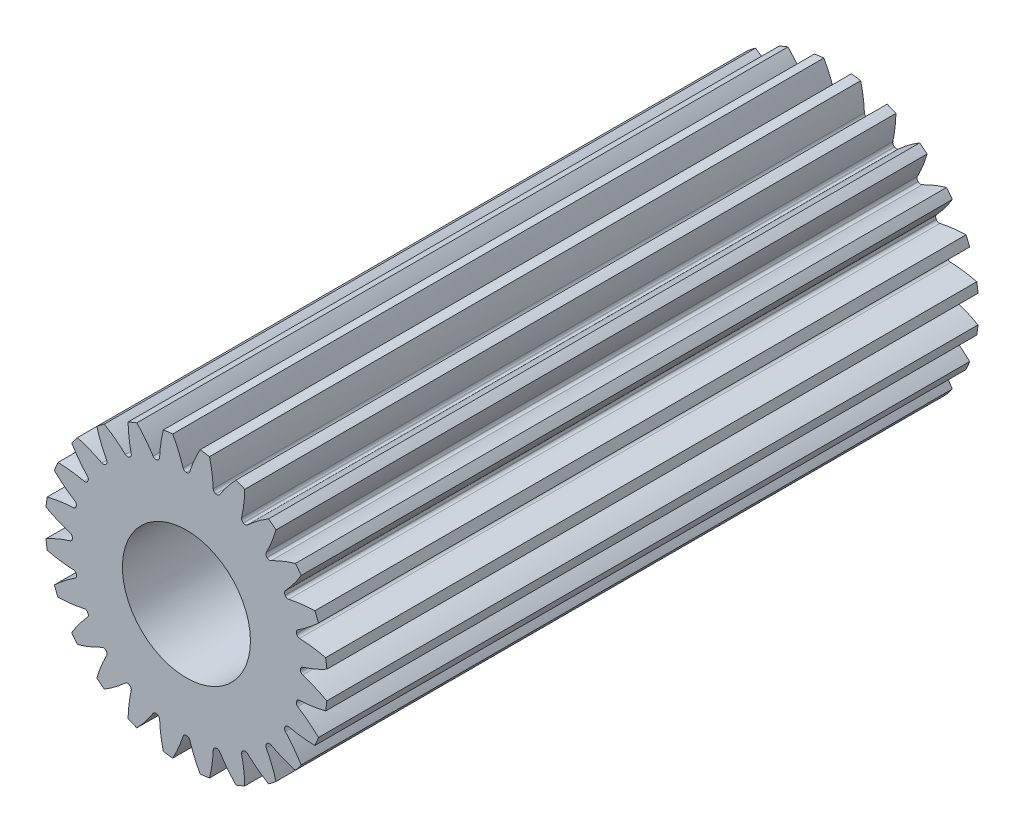
from build123d import *
from build123d.topology import SkipClean

# Parameters (mm, degrees)
CUT_EXTRUDE2_DEPTH  = 10.669539803
CIRPATTERN1_COUNT   = 24
BOSS_EXTRUDE1_START = 27
BOSS_EXTRUDE1_DEPTH = 27
CUT_EXTRUDE3_DEPTH  = 10
SKETCH10_R          = 2.949994
CUT_EXTRUDE4_DEPTH  = 10
FILLET1_R           = 0.25


with BuildPart() as part:
    # Sketch4 → Revolve1 (revolve)
    with BuildSketch(Plane(origin=(0, 0, 0), x_dir=(0, 0, -1), z_dir=(1, 0, 0))):
        Polygon((-3, 4), (-3, 6.5), (0, 6.5), (0, 2), (0, 0), (-3, 0), (-3, 2), align=None)
    revolve(axis=Axis((0, 0, 3), (0, 0, 1)))

    # Sketch7 → Cut-Extrude2 (cut, through all)
    with BuildSketch(Plane.XY.offset(3)):
        with BuildLine():
            ThreePointArc((-0.012291339, 5.249985612), (0, 5.25), (0.012291339, 5.249985612))
            ThreePointArc((0.012291339, 5.249985612), (0.10141019, 5.279068119), (0.155863571, 5.355375334))
            ThreePointArc((0.155863571, 5.355375334), (0.365213913, 5.92435749), (0.630915262, 6.469307995))
            ThreePointArc((0.630915262, 6.469307995), (0, 6.5), (-0.630915262, 6.469307995))
            ThreePointArc((-0.630915262, 6.469307995), (-0.365213913, 5.92435749), (-0.155863571, 5.355375334))
            ThreePointArc((-0.155863571, 5.355375334), (-0.10141019, 5.279068119), (-0.012291339, 5.249985612))
        make_face()
    cut_extrude2 = extrude(amount=-CUT_EXTRUDE2_DEPTH, mode=Mode.SUBTRACT)

    # CirPattern1: Cut-Extrude2 ×24 about axis
    cirpattern1_axis = Axis((0, 0, 0), (0, 0, 1))
    for i in range(1, CIRPATTERN1_COUNT):
        add(cut_extrude2.rotate(cirpattern1_axis, i * 360 / CIRPATTERN1_COUNT), mode=Mode.SUBTRACT)

    # Sketch8 → Boss-Extrude1 (add)
    with SkipClean():  # the faces are left unmerged after this step: merging them gives an invalid solid
        with BuildSketch(Plane.XY.offset(3).offset(BOSS_EXTRUDE1_START)):
            with BuildLine():
                ThreePointArc((-1.536625779, 5.132554884), (-1.886106099, 5.627965588), (-2.283797464, 6.085578785))
                ThreePointArc((-2.283797464, 6.085578785), (-2.48744231, 6.005216961), (-2.688265353, 5.918042699))
                ThreePointArc((-2.688265353, 5.918042699), (-2.645894219, 5.313251044), (-2.542705855, 4.715822871))
                ThreePointArc((-2.542705855, 4.715822871), (-2.551710259, 4.622512194), (-2.614348194, 4.552766579))
                ThreePointArc((-2.614348194, 4.552766579), (-2.625, 4.54663337), (-2.635637418, 4.54047524))
                ThreePointArc((-2.635637418, 4.54047524), (-2.72735786, 4.521102004), (-2.812669479, 4.559959301))
                ThreePointArc((-2.812669479, 4.559959301), (-3.278463271, 4.948037131), (-3.781042642, 5.287127437))
                ThreePointArc((-3.781042642, 5.287127437), (-3.956949289, 5.156796712), (-4.128367093, 5.020616013))
                ThreePointArc((-4.128367093, 5.020616013), (-3.930908121, 4.44739859), (-3.676610026, 3.897034402))
                ThreePointArc((-3.676610026, 3.897034402), (-3.661157032, 3.804572698), (-3.703609138, 3.720991716))
                ThreePointArc((-3.703609138, 3.720991716), (-3.712310601, 3.712310601), (-3.720991716, 3.703609138))
                ThreePointArc((-3.720991716, 3.703609138), (-3.804572698, 3.661157032), (-3.897034402, 3.676610026))
                ThreePointArc((-3.897034402, 3.676610026), (-4.44739859, 3.930908121), (-5.020616013, 4.128367093))
                ThreePointArc((-5.020616013, 4.128367093), (-5.156796712, 3.956949289), (-5.287127437, 3.781042642))
                ThreePointArc((-5.287127437, 3.781042642), (-4.948037131, 3.278463271), (-4.559959301, 2.812669479))
                ThreePointArc((-4.559959301, 2.812669479), (-4.521102004, 2.72735786), (-4.54047524, 2.635637418))
                ThreePointArc((-4.54047524, 2.635637418), (-4.54663337, 2.625), (-4.552766579, 2.614348194))
                ThreePointArc((-4.552766579, 2.614348194), (-4.622512194, 2.551710259), (-4.715822871, 2.542705855))
                ThreePointArc((-4.715822871, 2.542705855), (-5.313251044, 2.645894219), (-5.918042699, 2.688265353))
                ThreePointArc((-5.918042699, 2.688265353), (-6.005216961, 2.48744231), (-6.085578785, 2.283797464))
                ThreePointArc((-6.085578785, 2.283797464), (-5.627965588, 1.886106099), (-5.132554884, 1.536625779))
                ThreePointArc((-5.132554884, 1.536625779), (-5.072941346, 1.464278091), (-5.067915457, 1.370668785))
                ThreePointArc((-5.067915457, 1.370668785), (-5.071110588, 1.358799987), (-5.074277923, 1.346923741))
                ThreePointArc((-5.074277923, 1.346923741), (-5.125435123, 1.268368648), (-5.213235805, 1.235520482))
                ThreePointArc((-5.213235805, 1.235520482), (-5.81701422, 1.180566998), (-6.412164556, 1.064962772))
                ThreePointArc((-6.412164556, 1.064962772), (-6.444391599, 0.848420249), (-6.469307995, 0.630915262))
                ThreePointArc((-6.469307995, 0.630915262), (-5.92435749, 0.365213913), (-5.355375334, 0.155863571))
                ThreePointArc((-5.355375334, 0.155863571), (-5.279068119, 0.10141019), (-5.249985612, 0.012291339))
                ThreePointArc((-5.249985612, 0.012291339), (-5.25, 0), (-5.249985612, -0.012291339))
                ThreePointArc((-5.249985612, -0.012291339), (-5.279068119, -0.10141019), (-5.355375334, -0.155863571))
                ThreePointArc((-5.355375334, -0.155863571), (-5.92435749, -0.365213913), (-6.469307995, -0.630915262))
                ThreePointArc((-6.469307995, -0.630915262), (-6.444391599, -0.848420249), (-6.412164556, -1.064962772))
                ThreePointArc((-6.412164556, -1.064962772), (-5.81701422, -1.180566998), (-5.213235805, -1.235520482))
                ThreePointArc((-5.213235805, -1.235520482), (-5.125435123, -1.268368648), (-5.074277923, -1.346923741))
                ThreePointArc((-5.074277923, -1.346923741), (-5.071110588, -1.358799987), (-5.067915457, -1.370668785))
                ThreePointArc((-5.067915457, -1.370668785), (-5.072941346, -1.464278091), (-5.132554884, -1.536625779))
                ThreePointArc((-5.132554884, -1.536625779), (-5.627965588, -1.886106099), (-6.085578785, -2.283797464))
                ThreePointArc((-6.085578785, -2.283797464), (-6.005216961, -2.48744231), (-5.918042699, -2.688265353))
                ThreePointArc((-5.918042699, -2.688265353), (-5.313251044, -2.645894219), (-4.715822871, -2.542705855))
                ThreePointArc((-4.715822871, -2.542705855), (-4.622512194, -2.551710259), (-4.552766579, -2.614348194))
                ThreePointArc((-4.552766579, -2.614348194), (-4.54663337, -2.625), (-4.54047524, -2.635637418))
                ThreePointArc((-4.54047524, -2.635637418), (-4.521102004, -2.72735786), (-4.559959301, -2.812669479))
                ThreePointArc((-4.559959301, -2.812669479), (-4.948037131, -3.278463271), (-5.287127437, -3.781042642))
                ThreePointArc((-5.287127437, -3.781042642), (-5.156796712, -3.956949289), (-5.020616013, -4.128367093))
                ThreePointArc((-5.020616013, -4.128367093), (-4.44739859, -3.930908121), (-3.897034402, -3.676610026))
                ThreePointArc((-3.897034402, -3.676610026), (-3.804572698, -3.661157032), (-3.720991716, -3.703609138))
                ThreePointArc((-3.720991716, -3.703609138), (-3.712310601, -3.712310601), (-3.703609138, -3.720991716))
                ThreePointArc((-3.703609138, -3.720991716), (-3.661157032, -3.804572698), (-3.676610026, -3.897034402))
                ThreePointArc((-3.676610026, -3.897034402), (-3.930908121, -4.44739859), (-4.128367093, -5.020616013))
                ThreePointArc((-4.128367093, -5.020616013), (-3.956949289, -5.156796712), (-3.781042642, -5.287127437))
                ThreePointArc((-3.781042642, -5.287127437), (-3.278463271, -4.948037131), (-2.812669479, -4.559959301))
                ThreePointArc((-2.812669479, -4.559959301), (-2.72735786, -4.521102004), (-2.635637418, -4.54047524))
                ThreePointArc((-2.635637418, -4.54047524), (-2.625, -4.54663337), (-2.614348194, -4.552766579))
                ThreePointArc((-2.614348194, -4.552766579), (-2.551710259, -4.622512194), (-2.542705855, -4.715822871))
                ThreePointArc((-2.542705855, -4.715822871), (-2.645894219, -5.313251044), (-2.688265353, -5.918042699))
                ThreePointArc((-2.688265353, -5.918042699), (-2.48744231, -6.005216961), (-2.283797464, -6.085578785))
                ThreePointArc((-2.283797464, -6.085578785), (-1.886106099, -5.627965588), (-1.536625779, -5.132554884))
                ThreePointArc((-1.536625779, -5.132554884), (-1.464278091, -5.072941346), (-1.370668785, -5.067915457))
                ThreePointArc((-1.370668785, -5.067915457), (-1.358799987, -5.071110588), (-1.346923741, -5.074277923))
                ThreePointArc((-1.346923741, -5.074277923), (-1.268368648, -5.125435123), (-1.235520482, -5.213235805))
                ThreePointArc((-1.235520482, -5.213235805), (-1.180566998, -5.81701422), (-1.064962772, -6.412164556))
                ThreePointArc((-1.064962772, -6.412164556), (-0.848420249, -6.444391599), (-0.630915262, -6.469307995))
                ThreePointArc((-0.630915262, -6.469307995), (-0.365213913, -5.92435749), (-0.155863571, -5.355375334))
                ThreePointArc((-0.155863571, -5.355375334), (-0.10141019, -5.279068119), (-0.012291339, -5.249985612))
                ThreePointArc((-0.012291339, -5.249985612), (0, -5.25), (0.012291339, -5.249985612))
                ThreePointArc((0.012291339, -5.249985612), (0.10141019, -5.279068119), (0.155863571, -5.355375334))
                ThreePointArc((0.155863571, -5.355375334), (0.365213913, -5.92435749), (0.630915262, -6.469307995))
                ThreePointArc((0.630915262, -6.469307995), (0.848420249, -6.444391599), (1.064962772, -6.412164556))
                ThreePointArc((1.064962772, -6.412164556), (1.180566998, -5.81701422), (1.235520482, -5.213235805))
                ThreePointArc((1.235520482, -5.213235805), (1.268368648, -5.125435123), (1.346923741, -5.074277923))
                ThreePointArc((1.346923741, -5.074277923), (1.358799987, -5.071110588), (1.370668785, -5.067915457))
                ThreePointArc((1.370668785, -5.067915457), (1.464278091, -5.072941346), (1.536625779, -5.132554884))
                ThreePointArc((1.536625779, -5.132554884), (1.886106099, -5.627965588), (2.283797464, -6.085578785))
                ThreePointArc((2.283797464, -6.085578785), (2.48744231, -6.005216961), (2.688265353, -5.918042699))
                ThreePointArc((2.688265353, -5.918042699), (2.645894219, -5.313251044), (2.542705855, -4.715822871))
                ThreePointArc((2.542705855, -4.715822871), (2.551710259, -4.622512194), (2.614348194, -4.552766579))
                ThreePointArc((2.614348194, -4.552766579), (2.625, -4.54663337), (2.635637418, -4.54047524))
                ThreePointArc((2.635637418, -4.54047524), (2.72735786, -4.521102004), (2.812669479, -4.559959301))
                ThreePointArc((2.812669479, -4.559959301), (3.278463271, -4.948037131), (3.781042642, -5.287127437))
                ThreePointArc((3.781042642, -5.287127437), (3.956949289, -5.156796712), (4.128367093, -5.020616013))
                ThreePointArc((4.128367093, -5.020616013), (3.930908121, -4.44739859), (3.676610026, -3.897034402))
                ThreePointArc((3.676610026, -3.897034402), (3.661157032, -3.804572698), (3.703609138, -3.720991716))
                ThreePointArc((3.703609138, -3.720991716), (3.712310601, -3.712310601), (3.720991716, -3.703609138))
                ThreePointArc((3.720991716, -3.703609138), (3.804572698, -3.661157032), (3.897034402, -3.676610026))
                ThreePointArc((3.897034402, -3.676610026), (4.44739859, -3.930908121), (5.020616013, -4.128367093))
                ThreePointArc((5.020616013, -4.128367093), (5.156796712, -3.956949289), (5.287127437, -3.781042642))
                ThreePointArc((5.287127437, -3.781042642), (4.948037131, -3.278463271), (4.559959301, -2.812669479))
                ThreePointArc((4.559959301, -2.812669479), (4.521102004, -2.72735786), (4.54047524, -2.635637418))
                ThreePointArc((4.54047524, -2.635637418), (4.54663337, -2.625), (4.552766579, -2.614348194))
                ThreePointArc((4.552766579, -2.614348194), (4.622512194, -2.551710259), (4.715822871, -2.542705855))
                ThreePointArc((4.715822871, -2.542705855), (5.313251044, -2.645894219), (5.918042699, -2.688265353))
                ThreePointArc((5.918042699, -2.688265353), (6.005216961, -2.48744231), (6.085578785, -2.283797464))
                ThreePointArc((6.085578785, -2.283797464), (5.627965588, -1.886106099), (5.132554884, -1.536625779))
                ThreePointArc((5.132554884, -1.536625779), (5.072941346, -1.464278091), (5.067915457, -1.370668785))
                ThreePointArc((5.067915457, -1.370668785), (5.071110588, -1.358799987), (5.074277923, -1.346923741))
                ThreePointArc((5.074277923, -1.346923741), (5.125435123, -1.268368648), (5.213235805, -1.235520482))
                ThreePointArc((5.213235805, -1.235520482), (5.81701422, -1.180566998), (6.412164556, -1.064962772))
                ThreePointArc((6.412164556, -1.064962772), (6.444391599, -0.848420249), (6.469307995, -0.630915262))
                ThreePointArc((6.469307995, -0.630915262), (5.92435749, -0.365213913), (5.355375334, -0.155863571))
                ThreePointArc((5.355375334, -0.155863571), (5.279068119, -0.10141019), (5.249985612, -0.012291339))
                ThreePointArc((5.249985612, -0.012291339), (5.25, 0), (5.249985612, 0.012291339))
                ThreePointArc((5.249985612, 0.012291339), (5.279068119, 0.10141019), (5.355375334, 0.155863571))
                ThreePointArc((5.355375334, 0.155863571), (5.92435749, 0.365213913), (6.469307995, 0.630915262))
                ThreePointArc((6.469307995, 0.630915262), (6.444391599, 0.848420249), (6.412164556, 1.064962772))
                ThreePointArc((6.412164556, 1.064962772), (5.81701422, 1.180566998), (5.213235805, 1.235520482))
                ThreePointArc((5.213235805, 1.235520482), (5.125435123, 1.268368648), (5.074277923, 1.346923741))
                ThreePointArc((5.074277923, 1.346923741), (5.071110588, 1.358799987), (5.067915457, 1.370668785))
                ThreePointArc((5.067915457, 1.370668785), (5.072941346, 1.464278091), (5.132554884, 1.536625779))
                ThreePointArc((5.132554884, 1.536625779), (5.627965588, 1.886106099), (6.085578785, 2.283797464))
                ThreePointArc((6.085578785, 2.283797464), (6.005216961, 2.48744231), (5.918042699, 2.688265353))
                ThreePointArc((5.918042699, 2.688265353), (5.313251044, 2.645894219), (4.715822871, 2.542705855))
                ThreePointArc((4.715822871, 2.542705855), (4.622512194, 2.551710259), (4.552766579, 2.614348194))
                ThreePointArc((4.552766579, 2.614348194), (4.54663337, 2.625), (4.54047524, 2.635637418))
                ThreePointArc((4.54047524, 2.635637418), (4.521102004, 2.72735786), (4.559959301, 2.812669479))
                ThreePointArc((4.559959301, 2.812669479), (4.948037131, 3.278463271), (5.287127437, 3.781042642))
                ThreePointArc((5.287127437, 3.781042642), (5.156796712, 3.956949289), (5.020616013, 4.128367093))
                ThreePointArc((5.020616013, 4.128367093), (4.44739859, 3.930908121), (3.897034402, 3.676610026))
                ThreePointArc((3.897034402, 3.676610026), (3.804572698, 3.661157032), (3.720991716, 3.703609138))
                ThreePointArc((3.720991716, 3.703609138), (3.712310601, 3.712310601), (3.703609138, 3.720991716))
                ThreePointArc((3.703609138, 3.720991716), (3.661157032, 3.804572698), (3.676610026, 3.897034402))
                ThreePointArc((3.676610026, 3.897034402), (3.930908121, 4.44739859), (4.128367093, 5.020616013))
                ThreePointArc((4.128367093, 5.020616013), (3.956949289, 5.156796712), (3.781042642, 5.287127437))
                ThreePointArc((3.781042642, 5.287127437), (3.278463271, 4.948037131), (2.812669479, 4.559959301))
                ThreePointArc((2.812669479, 4.559959301), (2.72735786, 4.521102004), (2.635637418, 4.54047524))
                ThreePointArc((2.635637418, 4.54047524), (2.625, 4.54663337), (2.614348194, 4.552766579))
                ThreePointArc((2.614348194, 4.552766579), (2.551710259, 4.622512194), (2.542705855, 4.715822871))
                ThreePointArc((2.542705855, 4.715822871), (2.645894219, 5.313251044), (2.688265353, 5.918042699))
                ThreePointArc((2.688265353, 5.918042699), (2.48744231, 6.005216961), (2.283797464, 6.085578785))
                ThreePointArc((2.283797464, 6.085578785), (1.886106099, 5.627965588), (1.536625779, 5.132554884))
                ThreePointArc((1.536625779, 5.132554884), (1.464278091, 5.072941346), (1.370668785, 5.067915457))
                ThreePointArc((1.370668785, 5.067915457), (1.358799987, 5.071110588), (1.346923741, 5.074277923))
                ThreePointArc((1.346923741, 5.074277923), (1.268368648, 5.125435123), (1.235520482, 5.213235805))
                ThreePointArc((1.235520482, 5.213235805), (1.180566998, 5.81701422), (1.064962772, 6.412164556))
                ThreePointArc((1.064962772, 6.412164556), (0.848420249, 6.444391599), (0.630915262, 6.469307995))
                ThreePointArc((0.630915262, 6.469307995), (0.365213913, 5.92435749), (0.155863571, 5.355375334))
                ThreePointArc((0.155863571, 5.355375334), (0.10141019, 5.279068119), (0.012291339, 5.249985612))
                ThreePointArc((0.012291339, 5.249985612), (0, 5.25), (-0.012291339, 5.249985612))
                ThreePointArc((-0.012291339, 5.249985612), (-0.10141019, 5.279068119), (-0.155863571, 5.355375334))
                ThreePointArc((-0.155863571, 5.355375334), (-0.365213913, 5.92435749), (-0.630915262, 6.469307995))
                ThreePointArc((-0.630915262, 6.469307995), (-0.848420249, 6.444391599), (-1.064962772, 6.412164556))
                ThreePointArc((-1.064962772, 6.412164556), (-1.180566998, 5.81701422), (-1.235520482, 5.213235805))
                ThreePointArc((-1.235520482, 5.213235805), (-1.268368648, 5.125435123), (-1.346923741, 5.074277923))
                ThreePointArc((-1.346923741, 5.074277923), (-1.358799987, 5.071110588), (-1.370668785, 5.067915457))
                ThreePointArc((-1.370668785, 5.067915457), (-1.464278091, 5.072941346), (-1.536625779, 5.132554884))
            make_face()
        extrude(amount=-BOSS_EXTRUDE1_DEPTH)

    # Sketch9 → Cut-Extrude3 (cut)
    with SkipClean():  # the faces are left unmerged after this step: merging them gives an invalid solid
        with BuildSketch(Plane(origin=(0, 0, 0), x_dir=(-1, 0, 0), z_dir=(0, 0, -1))):
            with BuildLine():
                Line((-1.489963583, 1.5499972), (1.489963583, 1.5499972))
                ThreePointArc((1.489963583, 1.5499972), (0, -2.149996), (-1.489963583, 1.5499972))
            make_face()
        extrude(amount=-CUT_EXTRUDE3_DEPTH, mode=Mode.SUBTRACT)

    # Sketch10 → Cut-Extrude4 (cut)
    with SkipClean():  # the faces are left unmerged after this step: merging them gives an invalid solid
        with BuildSketch(Plane.XY.offset(30)):
            Circle(SKETCH10_R)
        extrude(amount=-CUT_EXTRUDE4_DEPTH, mode=Mode.SUBTRACT)

    # Fillet1
    fillet1_edges = [part.edges().sort_by_distance(p)[0] for p in [
        (0, -2.149996, 10),
        (0, 1.5499972, 10),
        (-2.949994, 0, 20),
    ]]
    fillet(fillet1_edges, radius=FILLET1_R)


solid = part.part
